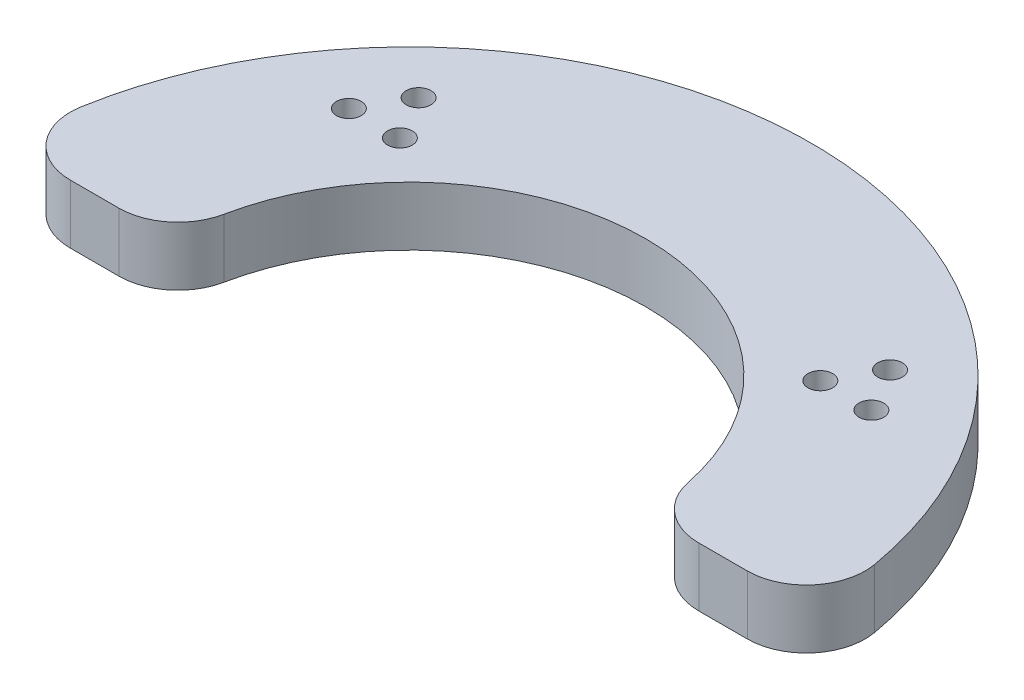
from build123d import *

# Parameters (mm, degrees)
SKETCH_2_R          = 68.303668196
SKETCH_2_R_2        = 10.05
SKETCH_2_R_3        = 40.203668196
EXTRUDE_1_DEPTH     = 10
EXTRUDE_START       = -5
SKETCH_3_R          = 10.05
EXTRUDE_2_DEPTH     = 5
SKETCH_4_W          = 280.2912044
SKETCH_4_H          = 106.849461173
CUT_EXTRUDE_2_DEPTH = 45
SKETCH_5_R          = 2.1
CUT_EXTRUDE_3_DEPTH = 45
FILLET_1_R          = 10


with BuildPart() as part:
    # 草图2 → 凸台-拉伸1 (new body)
    with BuildSketch(Plane(origin=(0, 0, 0), x_dir=(1, 0, 0), z_dir=(0, 1, 0))):
        with Locations(Location((0, 0, 0), (0, 0, 270))):
            Circle(SKETCH_2_R)
        with Locations(Location((40, 36.653246961, 0), (0, 0, 270))):
            Circle(SKETCH_2_R_2, mode=Mode.SUBTRACT)
        with Locations(Location((0, 0, 0), (0, 0, 270))):
            Circle(SKETCH_2_R_3, mode=Mode.SUBTRACT)
        with Locations(Location((-40, 36.653246961, 0), (0, 0, 90))):
            Circle(SKETCH_2_R_2, mode=Mode.SUBTRACT)
    extrude(amount=EXTRUDE_1_DEPTH)

    # 草图3 → 凸台-拉伸2 (add)
    with BuildSketch(Plane(origin=(0, 10, 0), x_dir=(1, 0, 0), z_dir=(0, 1, 0)).offset(EXTRUDE_START)):
        with Locations(Location((-40, 36.653246961, 0), (0, 0, 90))):
            Circle(SKETCH_3_R)
        with Locations(Location((40, 36.653246961, 0), (0, 0, 270))):
            Circle(SKETCH_3_R)
    extrude(amount=EXTRUDE_2_DEPTH)

    # 草图4 → 切除-拉伸2 (cut)
    with BuildSketch(Plane(origin=(0, 0, 0), x_dir=(-1, 0, 0), z_dir=(0, -1, 0))):
        with Locations((7.276792676, -53.424730587)):
            Rectangle(SKETCH_4_W, SKETCH_4_H)
    extrude(amount=-CUT_EXTRUDE_2_DEPTH, mode=Mode.SUBTRACT)

    # 草图5 → 切除-拉伸3 (cut)
    with BuildSketch(Plane(origin=(0, 5, 0), x_dir=(-1, 0, 0), z_dir=(0, -1, 0))):
        with Locations(Location((-40, 41.653246961, 0), (0, 0, 90))):
            Circle(SKETCH_5_R)
        with Locations(Location((-35.669872981, 34.153246961, 0), (0, 0, 90))):
            Circle(SKETCH_5_R)
        with Locations(Location((-44.330127019, 34.153246961, 0), (0, 0, 90))):
            Circle(SKETCH_5_R)
    cut_extrude_3 = extrude(amount=-CUT_EXTRUDE_3_DEPTH, mode=Mode.SUBTRACT)

    # 镜向1: 切除-拉伸3 across plane
    add(cut_extrude_3.mirror(Plane(origin=(0, 0, 0), x_dir=(0, 0, 1), z_dir=(1, 0, 0))), mode=Mode.SUBTRACT)

    # 圆角1
    fillet_1_edges = [part.edges().sort_by_distance(p)[0] for p in [
        (-40.203668196, 5, 0),
        (40.203668196, 5, 0),
        (68.303668196, 5, 0),
        (-68.303668196, 5, 0),
    ]]
    fillet(fillet_1_edges, radius=FILLET_1_R)


solid = part.part
